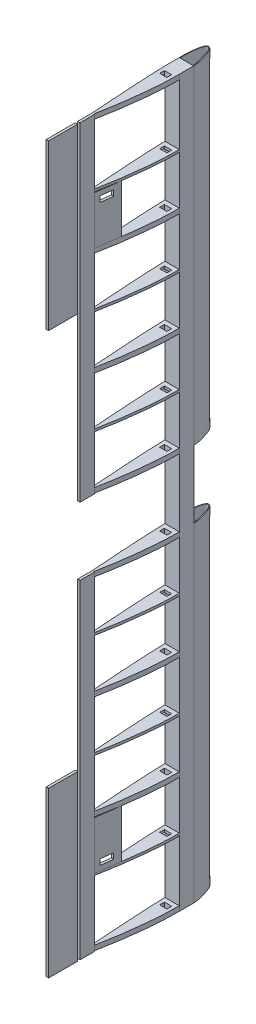
from build123d import *

# Parameters (mm, degrees)
SKETCH3_W                = 29.830994487
SKETCH3_H                = 30
BOSS_EXTRUDE1_DEPTH      = 680
BOSS_EXTRUDE2_DEPTH      = 680
SKETCH5_W                = 5
SKETCH5_H                = 29.625507425
BOSS_EXTRUDE3_DEPTH      = 680
BOSS_EXTRUDE4_DEPTH      = 680
BOSS_EXTRUDE4_DEPTH_BACK = 70
SKETCH3_2_W              = 29.830994487
SKETCH3_2_H              = 30
SKETCH6_W                = 15
SKETCH6_H                = 9.830994486
BOSS_EXTRUDE5_DEPTH      = 10
SKETCH7_W                = 15
SKETCH7_H                = 9.830994486
BOSS_EXTRUDE6_DEPTH      = 5
SKETCH8_W                = 15
SKETCH8_H                = 9.830994486
BOSS_EXTRUDE7_DEPTH      = 10
SKETCH9_W                = 15
SKETCH9_H                = 9.830994486
BOSS_EXTRUDE8_DEPTH      = 5
SKETCH10_W               = 15
SKETCH10_H               = 9.830994486
BOSS_EXTRUDE9_DEPTH      = 10
SKETCH11_W               = 15
SKETCH11_H               = 9.830994486
BOSS_EXTRUDE10_DEPTH     = 5
SKETCH12_W               = 15
SKETCH12_H               = 9.830994486
BOSS_EXTRUDE11_DEPTH     = 10
SKETCH18_W               = 50
SKETCH18_H               = 100
SKETCH18_W_2             = 25
SKETCH18_H_2             = 12
BOSS_EXTRUDE12_DEPTH     = 5
SKETCH19_W               = 5
SKETCH19_H               = 340
BOSS_EXTRUDE13_DEPTH     = 60


with BuildPart() as part:
    # Sketch3 → Boss-Extrude1 (new body)
    with BuildSketch(Plane(origin=(0, 0, 0), x_dir=(1, 0, 0), z_dir=(0, 1, 0))):
        with Locations((372.43379512, 394.554441461)):
            Rectangle(SKETCH3_W, SKETCH3_H)
    extrude(amount=BOSS_EXTRUDE1_DEPTH)

    # Sketch4 → Boss-Extrude2 (add)
    with BuildSketch(Plane(origin=(0, 0, 0), x_dir=(1, 0, 0), z_dir=(0, 1, 0))):
        with BuildLine():
            Line((358.565681537, 409.554441461), (357.518297876, 409.554441461))
            add(Edge.make_bspline(
                [(387.349292363, 409.554441461), (386.880782014, 416.232465642), (385.215363197, 427.977254743), (379.54238031, 443.006550539), (376.326173746, 453.291814061), (372.044342079, 458.061085694), (369.943079345, 459.581498945), (367.992944132, 460.007089978), (366.762820702, 459.676470544), (365.825289208, 459.170334253), (365.079373638, 458.530273396), (364.338310395, 457.678809484), (363.382025268, 456.347163683), (362.188173936, 454.014538498), (361.141436324, 450.635875627), (360.085781058, 446.73912733), (359.259914394, 442.149056887), (358.653505452, 437.085149688), (358.104613744, 431.361763586), (357.507713189, 422.234987632), (357.190624913, 414.830916865), (357.518297876, 409.554441461)],
                knots=[0, 0, 0, 0, 0.184001669, 0.320833682, 0.443039585, 0.471183025, 0.495286001, 0.513123361, 0.523587476, 0.529477768, 0.542257992, 0.550223409, 0.560410535, 0.587129607, 0.621575965, 0.657188306, 0.697781453, 0.749269884, 0.79698074, 0.855381655, 1, 1, 1, 1], degree=3))
            Line((387.349292363, 409.554441461), (385.764279006, 409.554441461))
            add(Edge.make_bspline(
                [(358.565681537, 409.554441461), (358.674251827, 414.714231011), (358.283364091, 422.332823611), (359.357870052, 431.552870293), (359.507771714, 437.684231213), (360.65263396, 443.004535882), (361.413244412, 448.399622906), (362.434023063, 453.237137264), (364.815995113, 456.576757023), (367.361520516, 458.640025216), (370.104331114, 458.295516329), (371.798135939, 456.107503797), (374.051845522, 453.268434758), (376.810607298, 446.941329287), (381.15974419, 432.295137007), (385.394684342, 419.325570985), (385.764279006, 409.554441461)],
                knots=[0, 0, 0, 0, 0.147490513, 0.21629048, 0.264477414, 0.322014764, 0.37074026, 0.420656278, 0.460242157, 0.486480574, 0.509556447, 0.529622191, 0.562888124, 0.613655781, 0.724082096, 1, 1, 1, 1], degree=3))
        make_face()
    extrude(amount=BOSS_EXTRUDE2_DEPTH)

    # Sketch3<2> → Boss-Extrude4 (add, two sides: drawn at the far end of the back side and taken through both)
    with BuildSketch(Plane(origin=(0, 0, 0), x_dir=(1, 0, 0), z_dir=(0, 1, 0)).offset(-BOSS_EXTRUDE4_DEPTH_BACK)):
        with Locations((372.43379512, 394.554441461)):
            Rectangle(SKETCH3_2_W, SKETCH3_2_H)
    extrude(amount=BOSS_EXTRUDE4_DEPTH + BOSS_EXTRUDE4_DEPTH_BACK)



with BuildPart() as body_2:
    # Sketch5 → Boss-Extrude3 (new body)
    with BuildSketch(Plane(origin=(0, 0, 0), x_dir=(1, 0, 0), z_dir=(0, 1, 0))):
        with Locations((369.123695536, 204.741687748)):
            Rectangle(SKETCH5_W, SKETCH5_H)
    extrude(amount=BOSS_EXTRUDE3_DEPTH)


with BuildPart() as part_1:
    add(part.part)

    add(body_2.part)  # Boss-Extrude5 merges body 2
    # Sketch6 → Boss-Extrude5 (add)
    with BuildSketch(Plane(origin=(0, 0, 0), x_dir=(1, 0, 0), z_dir=(0, 1, 0))):
        with BuildLine():
            Line((366.623695536, 219.554441461), (369.963401417, 219.554441461))
            add(Edge.make_bspline(
                [(369.963401417, 219.554441461), (371.451588772, 227.153494985), (373.693144069, 239.420986148), (376.766669982, 257.911558097), (379.708369427, 277.904363995), (382.181394209, 297.202643303), (384.300491978, 317.276099383), (385.4366365, 330.538451504), (386.374153906, 343.425688128), (387.058133215, 356.888971055), (387.34599887, 369.412796735), (387.36735195, 376.715599697), (387.349292363, 379.554441461)],
                knots=[0.019930297, 0.019930297, 0.019930297, 0.019930297, 0.072007874, 0.148069198, 0.252671344, 0.356546979, 0.456557232, 0.560314305, 0.628736547, 0.695155945, 0.764450588, 0.812295321, 0.812295321, 0.812295321, 0.812295321], degree=3))
            Line((387.349292363, 379.554441461), (357.518297876, 379.554441461))
            add(Edge.make_bspline(
                [(357.518297876, 379.554441461), (357.565784832, 377.895456102), (357.88624493, 367.464122476), (358.502117055, 350.798035719), (359.463842738, 331.538118052), (360.613478862, 311.788520684), (361.842319989, 291.866830859), (362.650050251, 278.947329991), (363.490497911, 265.767474839), (364.425288947, 251.716144412), (365.337371381, 238.375182493), (366.025270789, 228.28600782), (366.438142193, 222.234978261), (366.623695536, 219.554441461)],
                knots=[0.05424276, 0.05424276, 0.05424276, 0.05424276, 0.070037453, 0.160288267, 0.268351851, 0.368047246, 0.470323006, 0.573511372, 0.640433967, 0.708710545, 0.781514722, 0.850646806, 0.897725213, 0.897725213, 0.897725213, 0.897725213], degree=3))
        make_face()
        with Locations((372.89538519, 365.806478627)):
            Rectangle(SKETCH6_W, SKETCH6_H, mode=Mode.SUBTRACT)
    extrude(amount=BOSS_EXTRUDE5_DEPTH)

    # Sketch7 → Boss-Extrude6 (add)
    with BuildSketch(Plane(origin=(0, 110, 0), x_dir=(1, 0, 0), z_dir=(0, 1, 0))):
        with BuildLine():
            Line((366.623695536, 219.554441461), (369.963401417, 219.554441461))
            add(Edge.make_bspline(
                [(369.963401417, 219.554441461), (371.451588772, 227.153494985), (373.693144069, 239.420986148), (376.766669982, 257.911558097), (379.708369427, 277.904363995), (382.181394209, 297.202643303), (384.300491978, 317.276099383), (385.4366365, 330.538451504), (386.374153906, 343.425688128), (387.058133215, 356.888971055), (387.34599887, 369.412796735), (387.36735195, 376.715599697), (387.349292363, 379.554441461)],
                knots=[0.019930297, 0.019930297, 0.019930297, 0.019930297, 0.072007874, 0.148069198, 0.252671344, 0.356546979, 0.456557232, 0.560314305, 0.628736547, 0.695155945, 0.764450588, 0.812295321, 0.812295321, 0.812295321, 0.812295321], degree=3))
            Line((387.349292363, 379.554441461), (357.518297876, 379.554441461))
            add(Edge.make_bspline(
                [(357.518297876, 379.554441461), (357.565784832, 377.895456102), (357.88624493, 367.464122476), (358.502117055, 350.798035719), (359.463842738, 331.538118052), (360.613478862, 311.788520684), (361.842319989, 291.866830859), (362.650050251, 278.947329991), (363.490497911, 265.767474839), (364.425288947, 251.716144412), (365.337371381, 238.375182493), (366.025270789, 228.28600782), (366.438142193, 222.234978261), (366.623695536, 219.554441461)],
                knots=[0.05424276, 0.05424276, 0.05424276, 0.05424276, 0.070037453, 0.160288267, 0.268351851, 0.368047246, 0.470323006, 0.573511372, 0.640433967, 0.708710545, 0.781514722, 0.850646806, 0.897725213, 0.897725213, 0.897725213, 0.897725213], degree=3))
        make_face()
        with Locations((372.89538519, 365.806478627)):
            Rectangle(SKETCH7_W, SKETCH7_H, mode=Mode.SUBTRACT)
    extrude(amount=BOSS_EXTRUDE6_DEPTH)

    # Sketch8 → Boss-Extrude7 (add)
    with BuildSketch(Plane(origin=(0, 215, 0), x_dir=(1, 0, 0), z_dir=(0, 1, 0))):
        with BuildLine():
            Line((366.623695536, 219.554441461), (369.963401417, 219.554441461))
            add(Edge.make_bspline(
                [(369.963401417, 219.554441461), (371.451588772, 227.153494985), (373.693144069, 239.420986148), (376.766669982, 257.911558097), (379.708369427, 277.904363995), (382.181394209, 297.202643303), (384.300491978, 317.276099383), (385.4366365, 330.538451504), (386.374153906, 343.425688128), (387.058133215, 356.888971055), (387.34599887, 369.412796735), (387.36735195, 376.715599697), (387.349292363, 379.554441461)],
                knots=[0.019930297, 0.019930297, 0.019930297, 0.019930297, 0.072007874, 0.148069198, 0.252671344, 0.356546979, 0.456557232, 0.560314305, 0.628736547, 0.695155945, 0.764450588, 0.812295321, 0.812295321, 0.812295321, 0.812295321], degree=3))
            Line((387.349292363, 379.554441461), (357.518297876, 379.554441461))
            add(Edge.make_bspline(
                [(357.518297876, 379.554441461), (357.565784832, 377.895456102), (357.88624493, 367.464122476), (358.502117055, 350.798035719), (359.463842738, 331.538118052), (360.613478862, 311.788520684), (361.842319989, 291.866830859), (362.650050251, 278.947329991), (363.490497911, 265.767474839), (364.425288947, 251.716144412), (365.337371381, 238.375182493), (366.025270789, 228.28600782), (366.438142193, 222.234978261), (366.623695536, 219.554441461)],
                knots=[0.05424276, 0.05424276, 0.05424276, 0.05424276, 0.070037453, 0.160288267, 0.268351851, 0.368047246, 0.470323006, 0.573511372, 0.640433967, 0.708710545, 0.781514722, 0.850646806, 0.897725213, 0.897725213, 0.897725213, 0.897725213], degree=3))
        make_face()
        with Locations((372.89538519, 365.806478627)):
            Rectangle(SKETCH8_W, SKETCH8_H, mode=Mode.SUBTRACT)
    extrude(amount=BOSS_EXTRUDE7_DEPTH)

    # Sketch9 → Boss-Extrude8 (add)
    with BuildSketch(Plane(origin=(0, 325, 0), x_dir=(1, 0, 0), z_dir=(0, 1, 0))):
        with BuildLine():
            Line((366.623695536, 219.554441461), (369.963401417, 219.554441461))
            add(Edge.make_bspline(
                [(369.963401417, 219.554441461), (371.451588772, 227.153494985), (373.693144069, 239.420986148), (376.766669982, 257.911558097), (379.708369427, 277.904363995), (382.181394209, 297.202643303), (384.300491978, 317.276099383), (385.4366365, 330.538451504), (386.374153906, 343.425688128), (387.058133215, 356.888971055), (387.34599887, 369.412796735), (387.36735195, 376.715599697), (387.349292363, 379.554441461)],
                knots=[0.019930297, 0.019930297, 0.019930297, 0.019930297, 0.072007874, 0.148069198, 0.252671344, 0.356546979, 0.456557232, 0.560314305, 0.628736547, 0.695155945, 0.764450588, 0.812295321, 0.812295321, 0.812295321, 0.812295321], degree=3))
            Line((387.349292363, 379.554441461), (357.518297876, 379.554441461))
            add(Edge.make_bspline(
                [(357.518297876, 379.554441461), (357.565784832, 377.895456102), (357.88624493, 367.464122476), (358.502117055, 350.798035719), (359.463842738, 331.538118052), (360.613478862, 311.788520684), (361.842319989, 291.866830859), (362.650050251, 278.947329991), (363.490497911, 265.767474839), (364.425288947, 251.716144412), (365.337371381, 238.375182493), (366.025270789, 228.28600782), (366.438142193, 222.234978261), (366.623695536, 219.554441461)],
                knots=[0.05424276, 0.05424276, 0.05424276, 0.05424276, 0.070037453, 0.160288267, 0.268351851, 0.368047246, 0.470323006, 0.573511372, 0.640433967, 0.708710545, 0.781514722, 0.850646806, 0.897725213, 0.897725213, 0.897725213, 0.897725213], degree=3))
        make_face()
        with Locations((372.89538519, 365.806478627)):
            Rectangle(SKETCH9_W, SKETCH9_H, mode=Mode.SUBTRACT)
    extrude(amount=BOSS_EXTRUDE8_DEPTH)

    # Sketch10 → Boss-Extrude9 (add)
    with BuildSketch(Plane(origin=(0, 430, 0), x_dir=(1, 0, 0), z_dir=(0, 1, 0))):
        with BuildLine():
            Line((366.623695536, 219.554441461), (369.963401417, 219.554441461))
            add(Edge.make_bspline(
                [(369.963401417, 219.554441461), (371.451588772, 227.153494985), (373.693144069, 239.420986148), (376.766669982, 257.911558097), (379.708369427, 277.904363995), (382.181394209, 297.202643303), (384.300491978, 317.276099383), (385.4366365, 330.538451504), (386.374153906, 343.425688128), (387.058133215, 356.888971055), (387.34599887, 369.412796735), (387.36735195, 376.715599697), (387.349292363, 379.554441461)],
                knots=[0.019930297, 0.019930297, 0.019930297, 0.019930297, 0.072007874, 0.148069198, 0.252671344, 0.356546979, 0.456557232, 0.560314305, 0.628736547, 0.695155945, 0.764450588, 0.812295321, 0.812295321, 0.812295321, 0.812295321], degree=3))
            Line((387.349292363, 379.554441461), (357.518297876, 379.554441461))
            add(Edge.make_bspline(
                [(357.518297876, 379.554441461), (357.565784832, 377.895456102), (357.88624493, 367.464122476), (358.502117055, 350.798035719), (359.463842738, 331.538118052), (360.613478862, 311.788520684), (361.842319989, 291.866830859), (362.650050251, 278.947329991), (363.490497911, 265.767474839), (364.425288947, 251.716144412), (365.337371381, 238.375182493), (366.025270789, 228.28600782), (366.438142193, 222.234978261), (366.623695536, 219.554441461)],
                knots=[0.05424276, 0.05424276, 0.05424276, 0.05424276, 0.070037453, 0.160288267, 0.268351851, 0.368047246, 0.470323006, 0.573511372, 0.640433967, 0.708710545, 0.781514722, 0.850646806, 0.897725213, 0.897725213, 0.897725213, 0.897725213], degree=3))
        make_face()
        with Locations((372.89538519, 365.806478627)):
            Rectangle(SKETCH10_W, SKETCH10_H, mode=Mode.SUBTRACT)
    extrude(amount=BOSS_EXTRUDE9_DEPTH)

    # Sketch11 → Boss-Extrude10 (add)
    with BuildSketch(Plane(origin=(0, 540, 0), x_dir=(1, 0, 0), z_dir=(0, 1, 0))):
        with BuildLine():
            Line((366.623695536, 219.554441461), (369.963401417, 219.554441461))
            add(Edge.make_bspline(
                [(369.963401417, 219.554441461), (371.451588772, 227.153494985), (373.693144069, 239.420986148), (376.766669982, 257.911558097), (379.708369427, 277.904363995), (382.181394209, 297.202643303), (384.300491978, 317.276099383), (385.4366365, 330.538451504), (386.374153906, 343.425688128), (387.058133215, 356.888971055), (387.34599887, 369.412796735), (387.36735195, 376.715599697), (387.349292363, 379.554441461)],
                knots=[0.019930297, 0.019930297, 0.019930297, 0.019930297, 0.072007874, 0.148069198, 0.252671344, 0.356546979, 0.456557232, 0.560314305, 0.628736547, 0.695155945, 0.764450588, 0.812295321, 0.812295321, 0.812295321, 0.812295321], degree=3))
            Line((387.349292363, 379.554441461), (357.518297876, 379.554441461))
            add(Edge.make_bspline(
                [(357.518297876, 379.554441461), (357.565784832, 377.895456102), (357.88624493, 367.464122476), (358.502117055, 350.798035719), (359.463842738, 331.538118052), (360.613478862, 311.788520684), (361.842319989, 291.866830859), (362.650050251, 278.947329991), (363.490497911, 265.767474839), (364.425288947, 251.716144412), (365.337371381, 238.375182493), (366.025270789, 228.28600782), (366.438142193, 222.234978261), (366.623695536, 219.554441461)],
                knots=[0.05424276, 0.05424276, 0.05424276, 0.05424276, 0.070037453, 0.160288267, 0.268351851, 0.368047246, 0.470323006, 0.573511372, 0.640433967, 0.708710545, 0.781514722, 0.850646806, 0.897725213, 0.897725213, 0.897725213, 0.897725213], degree=3))
        make_face()
        with Locations((372.89538519, 365.806478627)):
            Rectangle(SKETCH11_W, SKETCH11_H, mode=Mode.SUBTRACT)
    extrude(amount=BOSS_EXTRUDE10_DEPTH)

    # Sketch12 → Boss-Extrude11 (add)
    with BuildSketch(Plane(origin=(0, 680, 0), x_dir=(1, 0, 0), z_dir=(0, 1, 0))):
        with BuildLine():
            Line((366.623695536, 219.554441461), (369.963401417, 219.554441461))
            add(Edge.make_bspline(
                [(369.963401417, 219.554441461), (371.451588772, 227.153494985), (373.693144069, 239.420986148), (376.766669982, 257.911558097), (379.708369427, 277.904363995), (382.181394209, 297.202643303), (384.300491978, 317.276099383), (385.4366365, 330.538451504), (386.374153906, 343.425688128), (387.058133215, 356.888971055), (387.34599887, 369.412796735), (387.36735195, 376.715599697), (387.349292363, 379.554441461)],
                knots=[0.019930297, 0.019930297, 0.019930297, 0.019930297, 0.072007874, 0.148069198, 0.252671344, 0.356546979, 0.456557232, 0.560314305, 0.628736547, 0.695155945, 0.764450588, 0.812295321, 0.812295321, 0.812295321, 0.812295321], degree=3))
            Line((387.349292363, 379.554441461), (357.518297876, 379.554441461))
            add(Edge.make_bspline(
                [(357.518297876, 379.554441461), (357.565784832, 377.895456102), (357.88624493, 367.464122476), (358.502117055, 350.798035719), (359.463842738, 331.538118052), (360.613478862, 311.788520684), (361.842319989, 291.866830859), (362.650050251, 278.947329991), (363.490497911, 265.767474839), (364.425288947, 251.716144412), (365.337371381, 238.375182493), (366.025270789, 228.28600782), (366.438142193, 222.234978261), (366.623695536, 219.554441461)],
                knots=[0.05424276, 0.05424276, 0.05424276, 0.05424276, 0.070037453, 0.160288267, 0.268351851, 0.368047246, 0.470323006, 0.573511372, 0.640433967, 0.708710545, 0.781514722, 0.850646806, 0.897725213, 0.897725213, 0.897725213, 0.897725213], degree=3))
        make_face()
        with Locations((372.89538519, 365.806478627)):
            Rectangle(SKETCH12_W, SKETCH12_H, mode=Mode.SUBTRACT)
    extrude(amount=-BOSS_EXTRUDE11_DEPTH)

    # Sketch18 → Boss-Extrude12 (add)
    with BuildSketch(Plane(origin=(335.363519965, 0, 45.822838091), x_dir=(0.13537844352071182, 0, -0.9907939629559264), z_dir=(0.9907939629559264, 0, 0.13537844352071182))):
        with Locations((292.871674687, 489.989504502)):
            Rectangle(SKETCH18_W, SKETCH18_H)
        with Locations((290.371674687, 523.989504502)):
            Rectangle(SKETCH18_W_2, SKETCH18_H_2, mode=Mode.SUBTRACT)
    extrude(amount=-BOSS_EXTRUDE12_DEPTH)

    # Mirror1: part across plane


with BuildPart() as part_2:
    add(part_1.part)
    add(part_1.part.mirror(Plane.ZX.offset(-70)))


with BuildPart() as body_2_2:
    # Sketch19 → Boss-Extrude13 (new body)
    with BuildSketch(Plane.XY.offset(-184.928934036)):
        with Locations((369.123695536, 510)):
            Rectangle(SKETCH19_W, SKETCH19_H)
    extrude(amount=BOSS_EXTRUDE13_DEPTH)


with BuildPart() as body_3:
    # Mirror2: mirrored copy
    add(body_2_2.part.mirror(Plane(origin=(0, -70, 0), x_dir=(0, 0, 1), z_dir=(0, -1, 0))))


solid = Compound([part_2.part, body_2_2.part, body_3.part])
